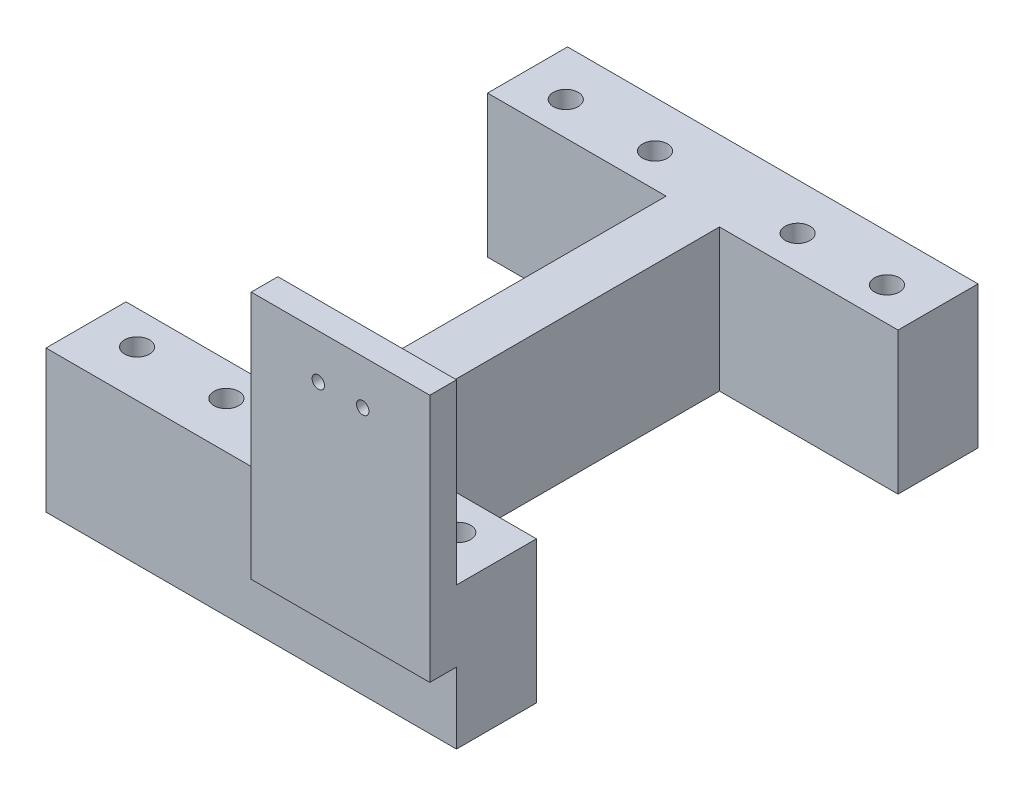
from build123d import *

# Parameters (mm, degrees)
EXTRUDE_2_DEPTH      = 8
EXTRUDE_2_DEPTH_BACK = 8
SKETCH_1_R           = 1.4
SKETCH_1_4_W         = 20.1
SKETCH_1_4_H         = 3
EXTRUDE_3_DEPTH      = 28
SKETCH_3_R           = 0.7
CUT_EXTRUDE_1_DEPTH  = 28


with BuildPart() as part:
    # Эскиз1 → Бобышка-Вытянуть2 (new, two sides: drawn at the far end of the back side and taken through both)
    with BuildSketch(Plane(origin=(0, 0, 0), x_dir=(1, 0, 0), z_dir=(0, 1, 0)).offset(-EXTRUDE_2_DEPTH_BACK)):
        Polygon((10.05, -29.35), (10.05, -20.35), (-10.05, -20.35), (-10.05, 20.35), (10.05, 20.35), (10.05, 29.35), (-36.15, 29.35), (-36.15, 20.35), (-16.05, 20.35), (-16.05, -20.35), (-36.15, -20.35), (-36.15, -29.35), align=None)
        with Locations((5.025, -24.125)):
            Circle(SKETCH_1_R, mode=Mode.SUBTRACT)
        with Locations((-5.025, -24.125)):
            Circle(SKETCH_1_R, mode=Mode.SUBTRACT)
        with Locations((-21.075, -24.125)):
            Circle(SKETCH_1_R, mode=Mode.SUBTRACT)
        with Locations((-31.125, -24.125)):
            Circle(SKETCH_1_R, mode=Mode.SUBTRACT)
        with Locations((-21.075, 24.125)):
            Circle(SKETCH_1_R, mode=Mode.SUBTRACT)
        with Locations((-31.125, 24.125)):
            Circle(SKETCH_1_R, mode=Mode.SUBTRACT)
        with Locations((5.025, 24.125)):
            Circle(SKETCH_1_R, mode=Mode.SUBTRACT)
        with Locations((-5.025, 24.125)):
            Circle(SKETCH_1_R, mode=Mode.SUBTRACT)
    extrude(amount=EXTRUDE_2_DEPTH + EXTRUDE_2_DEPTH_BACK)

    # Эскиз1<4> → Бобышка-Вытянуть3 (add)
    with BuildSketch(Plane(origin=(0, 0, 0), x_dir=(1, 0, 0), z_dir=(0, 1, 0))):
        with Locations((0, -30.85)):
            Rectangle(SKETCH_1_4_W, SKETCH_1_4_H)
    extrude(amount=EXTRUDE_3_DEPTH)

    # Эскиз3 → Вырез-Вытянуть1 (cut)
    with BuildSketch(Plane(origin=(0, 0, 29.35), x_dir=(-1, 0, 0), z_dir=(0, 0, -1))):
        with Locations((-2.5, 23)):
            Circle(SKETCH_3_R)
        with Locations((2.5, 23)):
            Circle(SKETCH_3_R)
    extrude(amount=-CUT_EXTRUDE_1_DEPTH, mode=Mode.SUBTRACT)


solid = part.part
